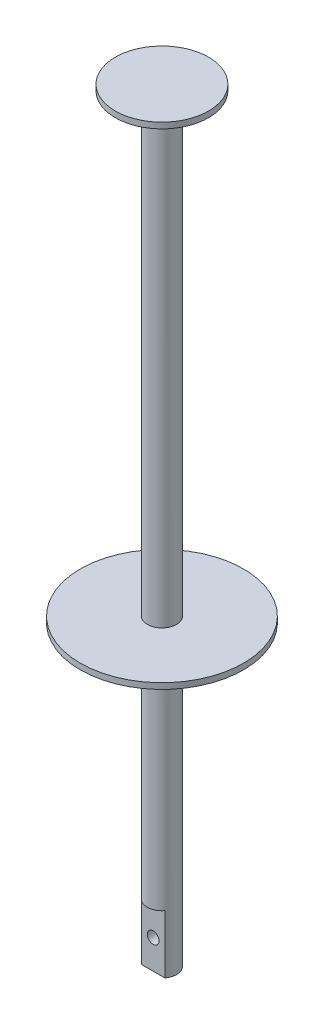
from build123d import *

# Parameters (mm, degrees)
SKETCH_1_R          = 8
EXTRUDE_1_DEPTH     = 1
SKETCH_3_R          = 2.5
EXTRUDE_2_DEPTH     = 130
SKETCH_5_W          = 1
SKETCH_5_H          = 10
CUT_EXTRUDE_1_DEPTH = 131.668473627
SKETCH_6_R          = 1
CUT_EXTRUDE_2_DEPTH = 131.591921649
SKETCH_8_R          = 14
EXTRUDE_3_DEPTH     = 1


with BuildPart() as part:
    # 草图1 → 凸台-拉伸1 (new body)
    with BuildSketch(Plane(origin=(0, 0, 0), x_dir=(1, 0, 0), z_dir=(0, 1, 0))):
        with Locations(Location((0, 0, 0), (0, 0, 270))):
            Circle(SKETCH_1_R)
    extrude(amount=EXTRUDE_1_DEPTH)

    # 草图3 → 凸台-拉伸2 (add)
    with BuildSketch(Plane.XZ):
        with Locations(Location((0, 0, 0), (0, 0, 270))):
            Circle(SKETCH_3_R)
    extrude(amount=EXTRUDE_2_DEPTH)

    # 草图5 → 切除-拉伸1 (cut, through all)
    with BuildSketch(Plane(origin=(2.5, 0, 0), x_dir=(0, 0, -1), z_dir=(1, 0, 0))):
        with Locations((-2, -125)):
            Rectangle(SKETCH_5_W, SKETCH_5_H)
        with Locations((2, -125)):
            Rectangle(SKETCH_5_W, SKETCH_5_H)
    extrude(amount=-CUT_EXTRUDE_1_DEPTH, mode=Mode.SUBTRACT)

    # 草图6 → 切除-拉伸2 (cut, through all)
    with BuildSketch(Plane.XY.offset(1.5)):
        with Locations((0, -125)):
            Circle(SKETCH_6_R)
    extrude(amount=-CUT_EXTRUDE_2_DEPTH, mode=Mode.SUBTRACT)

    # 草图8 → 凸台-拉伸3 (add)
    with BuildSketch(Plane(origin=(0, -79, 0), x_dir=(1, 0, 0), z_dir=(0, 1, 0))):
        with Locations(Location((0, 0, 0), (0, 0, 270))):
            Circle(SKETCH_8_R)
    extrude(amount=EXTRUDE_3_DEPTH)


solid = part.part
